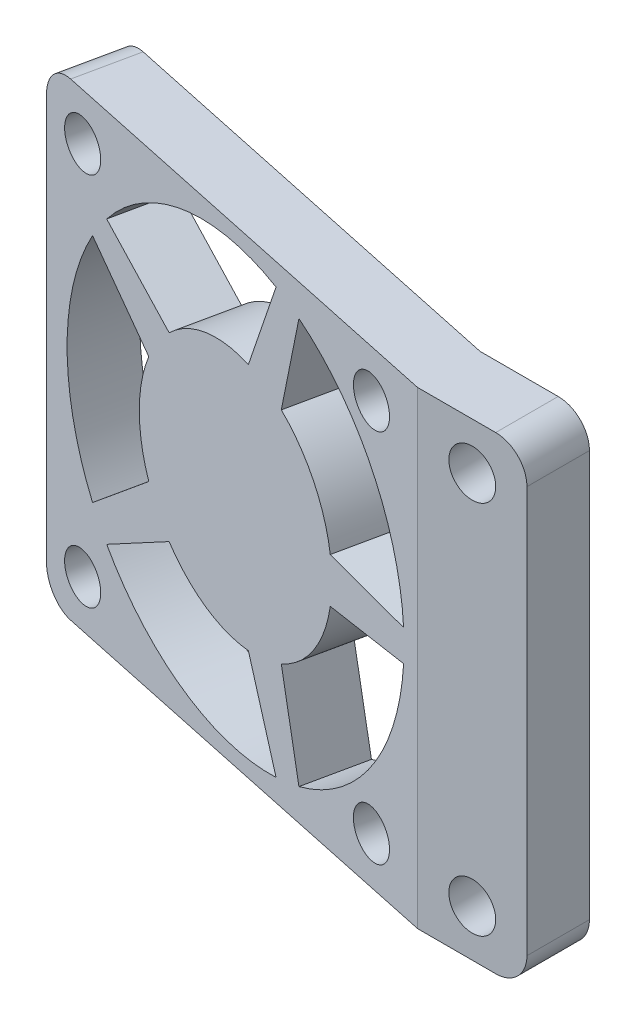
from build123d import *

# Parameters (mm, degrees)
SKETCH_1_W          = 7
SKETCH_1_H          = 30
EXTRUDE_1_DEPTH     = 4
EXTRUDE_2_DEPTH     = 30
SKETCH_3_R          = 1.5
CUT_EXTRUDE_2_DEPTH = 38.373237277
SKETCH_4_R          = 1.5
CUT_EXTRUDE_3_DEPTH = 38.362858307
SKETCH_5_R          = 14
CUT_EXTRUDE_4_DEPTH = 38.362858307
FILLET_1_R          = 2
FILLET_2_R          = 2
EXTRUDE_START       = -3.912590403
EXTRUDE_4_DEPTH     = 3.912590403


with BuildPart() as part:
    # 草圖1 → 填料-伸長1 (new body)
    with BuildSketch(Plane.XY):
        Rectangle(SKETCH_1_W, SKETCH_1_H)
    extrude(amount=EXTRUDE_1_DEPTH)

    # 草圖2 → 填料-伸長2 (add)
    with BuildSketch(Plane.XZ.offset(15)):
        Polygon((-3.5, 0), (-32.844428022, -6.237350725), (-33.657901308, -2.410259809), (-3.5, 4), align=None)
    extrude(amount=-EXTRUDE_2_DEPTH)

    # 草圖3 → 除料-伸長2 (cut, through all)
    with BuildSketch(Plane(origin=(0, 0, 0), x_dir=(-1, 0, 0), z_dir=(0, 0, -1))):
        with Locations((0, -12)):
            Circle(SKETCH_3_R)
        with Locations((0, 12)):
            Circle(SKETCH_3_R)
    extrude(amount=-CUT_EXTRUDE_2_DEPTH, mode=Mode.SUBTRACT)

    # 草圖4 → 除料-伸長3 (cut, through all)
    with BuildSketch(Plane(origin=(-0.151295449, 0, 0.711789125), x_dir=(-0.978147600733807, 0, -0.2079116908177533), z_dir=(0.2079116908177533, 0, -0.978147600733807))):
        with Locations((30.423516603, -12)):
            Circle(SKETCH_4_R)
        with Locations(Location((30.423516603, 12, 0), (0, 0, 180))):
            Circle(SKETCH_4_R)
        with Locations((6.423516603, 12)):
            Circle(SKETCH_4_R)
        with Locations(Location((6.423516603, -12, 0), (0, 0, 180))):
            Circle(SKETCH_4_R)
    extrude(amount=-CUT_EXTRUDE_3_DEPTH, mode=Mode.SUBTRACT)

    # 草圖5 → 除料-伸長4 (cut, through all)
    with BuildSketch(Plane(origin=(-0.151295449, 0, 0.711789125), x_dir=(-0.978147600733807, 0, -0.2079116908177533), z_dir=(0.2079116908177533, 0, -0.978147600733807))):
        with Locations((17.717091252, 0)):
            Circle(SKETCH_5_R)
    extrude(amount=-CUT_EXTRUDE_4_DEPTH, mode=Mode.SUBTRACT)

    # 圓角1
    fillet_1_edges = [part.edges().sort_by_distance(p)[0] for p in [
        (-33.251164665, -15, -4.323805267),
        (-33.251164665, 15, -4.323805267),
    ]]
    fillet(fillet_1_edges, radius=FILLET_1_R)

    # 圓角2
    fillet_2_edges = [part.edges().sort_by_distance(p)[0] for p in [
        (3.5, 15, 2),
        (3.5, -15, 2),
    ]]
    fillet(fillet_2_edges, radius=FILLET_2_R)

    # 草圖7 → 填料-伸長4 (add)
    with BuildSketch(Plane(origin=(-0.964768735, 0, 4.538880041), x_dir=(0.978147600733807, 0, 0.20791169081775324), z_dir=(-0.20791169081775324, 0, 0.978147600733807)).offset(EXTRUDE_START)):
        with BuildLine():
            Line((-3.752851208, 1), (-9.847302899, 1.43750871))
            ThreePointArc((-9.847302899, 1.43750871), (-11.244955297, 4.702282018), (-13.918040883, 7.040398873))
            Line((-13.918040883, 7.040398873), (-12.450847248, 12.971764494))
            ThreePointArc((-12.450847248, 12.971764494), (-13.39085333, 13.314791228), (-14.352960281, 13.589798483))
            Line((-14.352960281, 13.589798483), (-16.652344934, 7.928828115))
            ThreePointArc((-16.652344934, 7.928828115), (-20.189227207, 7.60845213), (-23.238937351, 5.788714508))
            Line((-23.238937351, 5.788714508), (-28.426613508, 9.016991352))
            ThreePointArc((-28.426613508, 9.016991352), (-29.043329173, 8.228993532), (-29.602184013, 7.398957363))
            Line((-29.602184013, 7.398957363), (-24.92883019, 3.462776556))
            ThreePointArc((-24.92883019, 3.462776556), (-25.717091252, 0), (-24.92883019, -3.462776556))
            Line((-24.92883019, -3.462776556), (-29.602184013, -7.398957363))
            ThreePointArc((-29.602184013, -7.398957363), (-29.043329173, -8.228993532), (-28.426613508, -9.016991352))
            Line((-28.426613508, -9.016991352), (-23.238937351, -5.788714508))
            ThreePointArc((-23.238937351, -5.788714508), (-20.189227207, -7.60845213), (-16.652344934, -7.928828115))
            Line((-16.652344934, -7.928828115), (-14.352960281, -13.589798483))
            ThreePointArc((-14.352960281, -13.589798483), (-13.39085333, -13.314791228), (-12.450847248, -12.971764494))
            Line((-12.450847248, -12.971764494), (-13.918040883, -7.040398873))
            ThreePointArc((-13.918040883, -7.040398873), (-11.244955297, -4.702282018), (-9.847302899, -1.43750871))
            Line((-9.847302899, -1.43750871), (-3.752851208, -1))
            ThreePointArc((-3.752851208, -1), (-3.717091252, 0), (-3.752851208, 1))
        make_face()
    extrude(amount=EXTRUDE_4_DEPTH)


solid = part.part
